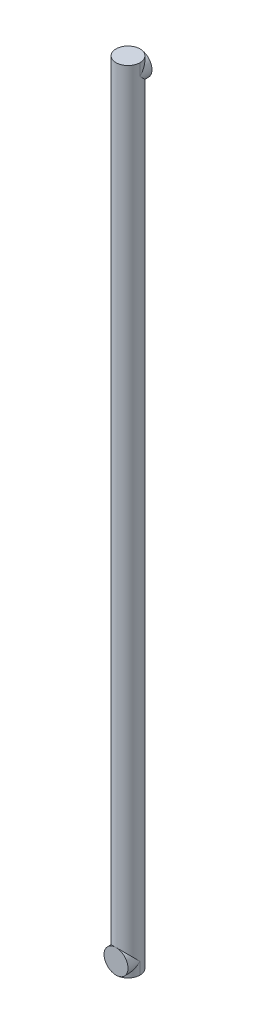
from build123d import *

# Parameters (mm, degrees)
SKETCH_2_R      = 2.5
EXTRUDE_1_DEPTH = 165
SKETCH_3_R      = 2.5
EXTRUDE_2_DEPTH = 2.5
SKETCH_4_R      = 2.5
EXTRUDE_3_DEPTH = 2.5


with BuildPart() as part:
    # 스케치2 → 보스-돌출1 (new body)
    with BuildSketch(Plane(origin=(0, 0, 0), x_dir=(1, 0, 0), z_dir=(0, 1, 0))):
        with Locations(Location((0, 0, 0), (0, 0, 270))):
            Circle(SKETCH_2_R)
    extrude(amount=EXTRUDE_1_DEPTH)

    # 스케치3 → 보스-돌출2 (add)
    with BuildSketch(Plane.XY):
        with Locations((0, 2.5)):
            Circle(SKETCH_3_R)
    extrude(amount=EXTRUDE_2_DEPTH)

    # 스케치4 → 보스-돌출3 (add)
    with BuildSketch(Plane.XY):
        with Locations((0, 162.5)):
            Circle(SKETCH_4_R)
    extrude(amount=-EXTRUDE_3_DEPTH)


solid = part.part
